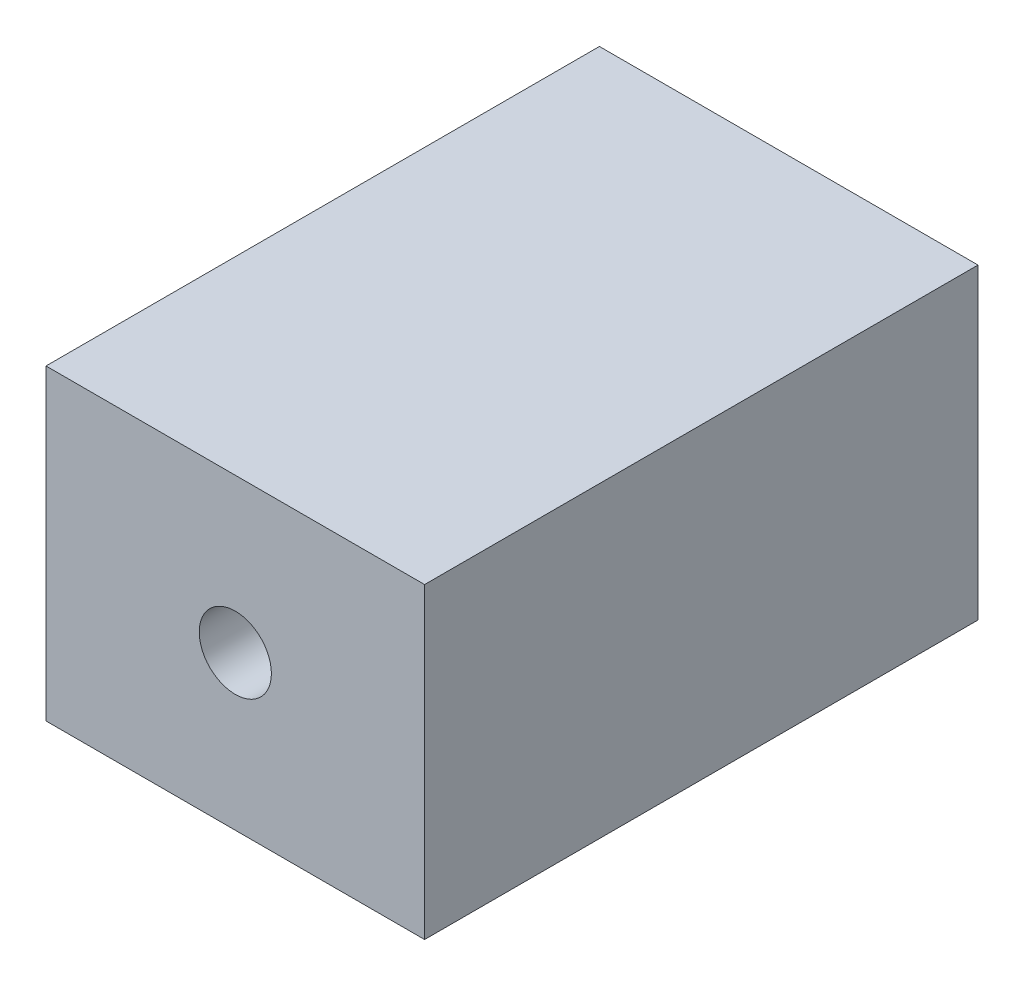
from build123d import *

# Parameters (mm, degrees)
SKETCH1_W                                     = 74.5
SKETCH1_H                                     = 60.5
SKETCH1_R                                     = 7.1
CONSERVATIVE_MANUFACTURER_CASE_ENVELOPE_DEPTH = 108.9
D50_PILOT_ENVELOPE_START                      = -2
SKETCH2_R                                     = 25
SKETCH2_R_2                                   = 7.1
D50_PILOT_ENVELOPE_DEPTH                      = 2


with BuildPart() as part:
    # Sketch1 → Conservative_Manufacturer_Case_Envelope (new body)
    with BuildSketch(Plane.XY):
        Rectangle(SKETCH1_W, SKETCH1_H)
        Circle(SKETCH1_R, mode=Mode.SUBTRACT)
    extrude(amount=CONSERVATIVE_MANUFACTURER_CASE_ENVELOPE_DEPTH)

    # Sketch2 → D50_Pilot_Envelope (add)
    with BuildSketch(Plane.XY.offset(D50_PILOT_ENVELOPE_START)):
        Circle(SKETCH2_R)
        Circle(SKETCH2_R_2, mode=Mode.SUBTRACT)
    extrude(amount=D50_PILOT_ENVELOPE_DEPTH)


solid = part.part
